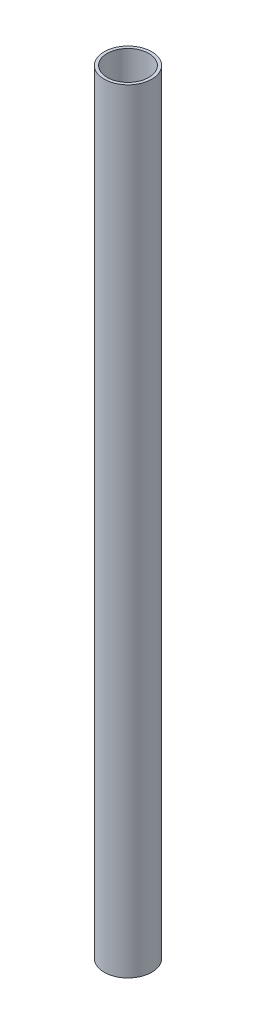
from build123d import *

# Parameters (mm, degrees)
SKETCH1_R           = 20
SKETCH1_R_2         = 17.5
BOSS_EXTRUDE1_DEPTH = 650


with BuildPart() as part:
    # Sketch1 → Boss-Extrude1 (new body)
    with BuildSketch(Plane(origin=(0, 0, 0), x_dir=(1, 0, 0), z_dir=(0, 1, 0))):
        with Locations(Location((0, 0, 0), (0, 0, 270))):
            Circle(SKETCH1_R)
        with Locations(Location((0, 0, 0), (0, 0, 270))):
            Circle(SKETCH1_R_2, mode=Mode.SUBTRACT)
    extrude(amount=BOSS_EXTRUDE1_DEPTH)


solid = part.part
